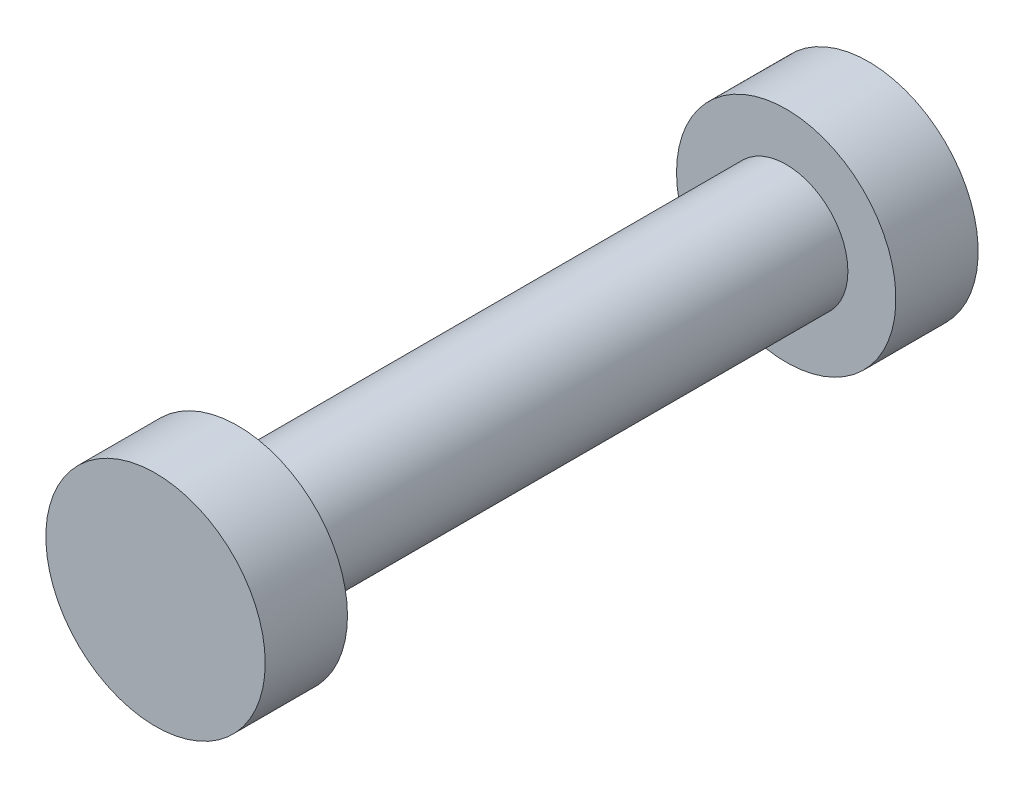
from build123d import *

# Parameters (mm, degrees)
CROQUIS1_R              = 2.25
SALIENTE_EXTRUIR1_DEPTH = 20
CROQUIS2_R              = 4
SALIENTE_EXTRUIR2_DEPTH = 3
SALIENTE_EXTRUIR3_START = 3
CROQUIS3_R              = 4
SALIENTE_EXTRUIR3_DEPTH = 3


with BuildPart() as part:
    # Croquis1 → Saliente-Extruir1 (new body)
    with BuildSketch(Plane.XY):
        Circle(CROQUIS1_R)
    extrude(amount=SALIENTE_EXTRUIR1_DEPTH)

    # Croquis2 → Saliente-Extruir2 (add)
    with BuildSketch(Plane.XY.offset(20)):
        Circle(CROQUIS2_R)
    extrude(amount=SALIENTE_EXTRUIR2_DEPTH)

    # Croquis3 → Saliente-Extruir3 (add)
    with BuildSketch(Plane(origin=(0, 0, 0), x_dir=(-1, 0, 0), z_dir=(0, 0, -1)).offset(SALIENTE_EXTRUIR3_START)):
        with Locations(Location((0, 0, 0), (0, 0, 180))):
            Circle(CROQUIS3_R)
    extrude(amount=-SALIENTE_EXTRUIR3_DEPTH)


solid = part.part
